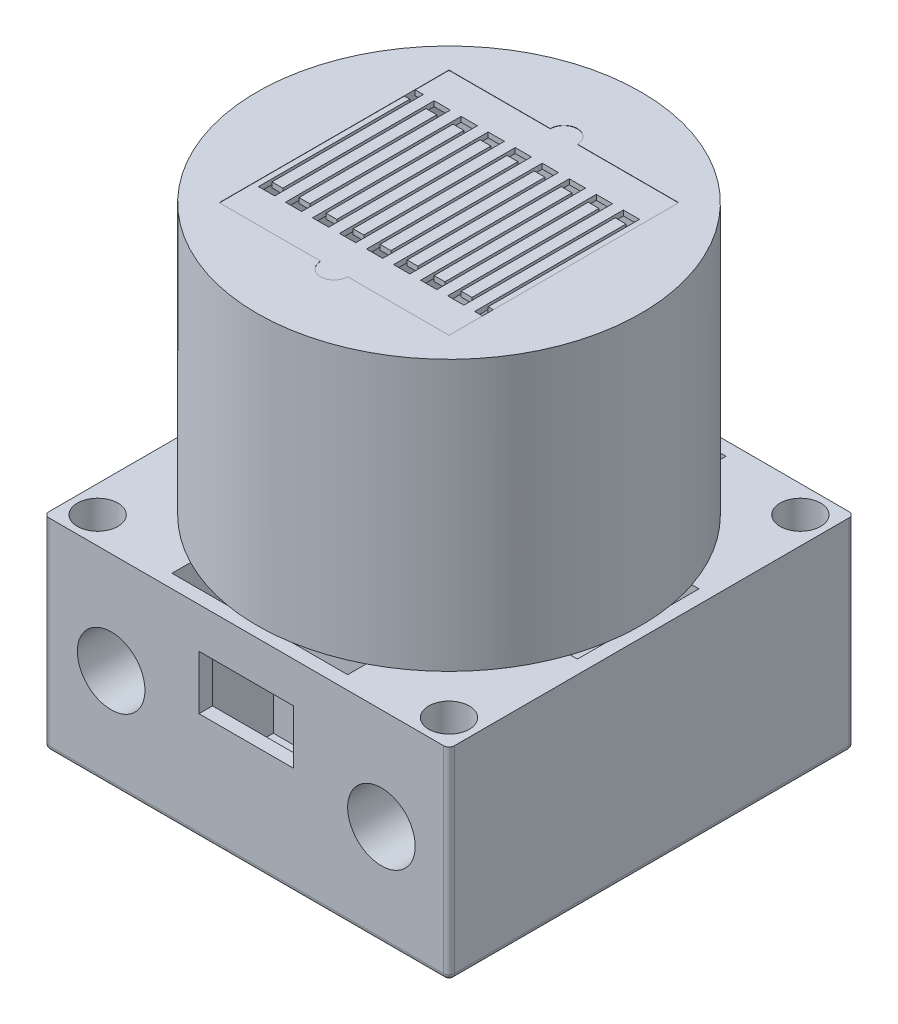
from build123d import *

# Parameters (mm, degrees)
SKETCH_2_W                      = 15
SKETCH_2_H                      = 15
EXTRUDE_1_DEPTH                 = 7.5
SKETCH_3_W                      = 14
SKETCH_3_H                      = 4.5
CUT_EXTRUDE_1_DEPTH             = 7
SKETCH_4_R                      = 3
CUT_EXTRUDE_2_DEPTH             = 4.5
SKETCH_5_W                      = 6.5
SKETCH_5_H                      = 3.75
CUT_EXTRUDE_3_DEPTH             = 7
EXTRUDE_2_REACH                 = 20.371
SKETCH_6_R                      = 1.5
SKETCH_7_R                      = 1.25
CUT_EXTRUDE_4_DEPTH             = 19.371173071
SKETCH_8_W                      = 3
SKETCH_8_H                      = 3
EXTRUDE_3_DEPTH                 = 1
CUT_EXTRUDE_5_REACH             = 20.371
SKETCH_9_W                      = 3.5
SKETCH_9_H                      = 2
CUT_EXTRUDE_6_REACH             = 35.371
CUT_EXTRUDE_START               = -15
SKETCH_9_2_W                    = 3.5
SKETCH_9_2_H                    = 2
EXTRUDE_4_DEPTH                 = 2
EXTRUDE_4_DEPTH_BACK            = 2
CUT_EXTRUDE_7_REACH             = 14.99
CUT_EXTRUDE_7_DIRECTION_2_REACH = 14.99
FILLET_1_R                      = 0.1
FILLET_2_R                      = 0.2
SKETCH_12_R                     = 0.75
CUT_EXTRUDE_8_DEPTH             = 2
SKETCH_13_W                     = 11.5
SKETCH_13_H                     = 4
EXTRUDE_5_DEPTH                 = 1
SKETCH_14_R                     = 2.9
EXTRUDE_6_DEPTH                 = 4
SKETCH_15_R                     = 2.5
CUT_EXTRUDE_9_DEPTH             = 3.5
SKETCH_19_R                     = 7.1
SKETCH_19_W                     = 8.5
SKETCH_19_H                     = 8.5
EXTRUDE_11_DEPTH                = 10
SKETCH_20_W                     = 8.5
SKETCH_20_H                     = 8.5
EXTRUDE_12_DEPTH                = 0.2
CUT_EXTRUDE_10_DEPTH            = 0.2
PATTERN_LINEAR_1_COUNT          = 8
PATTERN_LINEAR_1_PITCH          = 1
CUT_EXTRUDE_12_DEPTH            = 0.2
CUT_EXTRUDE_13_DEPTH            = 0.01


with BuildPart() as part:
    # 草图2 → 凸台-拉伸1 (new body)
    with BuildSketch(Plane(origin=(0, 0, 0), x_dir=(1, 0, 0), z_dir=(0, 1, 0))):
        Rectangle(SKETCH_2_W, SKETCH_2_H)
    extrude(amount=EXTRUDE_1_DEPTH)

    # 草图3 → 切除-拉伸1 (cut)
    with BuildSketch(Plane(origin=(0, 7.5, 0), x_dir=(-1, 0, 0), z_dir=(0, 1, 0))):
        Rectangle(SKETCH_3_W, SKETCH_3_H)
    extrude(amount=-CUT_EXTRUDE_1_DEPTH, mode=Mode.SUBTRACT)

    # 草图4 → 切除-拉伸2 (cut)
    with BuildSketch(Plane(origin=(0, 7.5, 0), x_dir=(1, 0, 0), z_dir=(0, 1, 0))):
        Circle(SKETCH_4_R)
    extrude(amount=-CUT_EXTRUDE_2_DEPTH, mode=Mode.SUBTRACT)

    # 草图5 → 切除-拉伸3 (cut)
    with BuildSketch(Plane(origin=(0, 7.5, 0), x_dir=(-1, 0, 0), z_dir=(0, 1, 0))):
        with Locations((0, -5.125)):
            Rectangle(SKETCH_5_W, SKETCH_5_H)
        with Locations((0, 5.125)):
            Rectangle(SKETCH_5_W, SKETCH_5_H)
    extrude(amount=-CUT_EXTRUDE_3_DEPTH, mode=Mode.SUBTRACT)

    # 草图6 → 凸台-拉伸2 (add, up to next)
    with BuildSketch(Plane.XY.offset(7.5), mode=Mode.PRIVATE) as extrude_2_sk1:
        with Locations((-5, 3.75)):
            Circle(SKETCH_6_R)
    extrude_2_tool1 = extrude(extrude_2_sk1.sketch, amount=-EXTRUDE_2_REACH, mode=Mode.PRIVATE) - part.part
    # 草图6 → 凸台-拉伸2 (add, up to next)
    with BuildSketch(Plane.XY.offset(7.5), mode=Mode.PRIVATE) as extrude_2_sk2:
        with Locations((5, 3.75)):
            Circle(SKETCH_6_R)
    extrude_2_tool2 = extrude(extrude_2_sk2.sketch, amount=-EXTRUDE_2_REACH, mode=Mode.PRIVATE) - part.part
    add(extrude_2_tool1.solids().sort_by_distance((-5, 3.75, 7.5))[0])
    add(extrude_2_tool2.solids().sort_by_distance((5, 3.75, 7.5))[0])

    # 草图7 → 切除-拉伸4 (cut, through all)
    with BuildSketch(Plane.XY.offset(7.5)):
        with Locations((-5, 3.75)):
            Circle(SKETCH_7_R)
        with Locations((5, 3.75)):
            Circle(SKETCH_7_R)
    extrude(amount=-CUT_EXTRUDE_4_DEPTH, mode=Mode.SUBTRACT)

    # 草图8 → 凸台-拉伸3 (add)
    with BuildSketch(Plane.XZ):
        Rectangle(SKETCH_8_W, SKETCH_8_H)
    extrude(amount=EXTRUDE_3_DEPTH)

    # 草图9 → 切除-拉伸5 (cut, up to next)
    with BuildSketch(Plane.XY.offset(7.5), mode=Mode.PRIVATE) as cut_extrude_5_sk1:
        with Locations((0, 5)):
            Rectangle(SKETCH_9_W, SKETCH_9_H)
    cut_extrude_5_tool1 = extrude(cut_extrude_5_sk1.sketch, amount=-CUT_EXTRUDE_5_REACH, mode=Mode.PRIVATE) & part.part
    add(cut_extrude_5_tool1.solids().sort_by_distance((0, 5, 7.5))[0], mode=Mode.SUBTRACT)

    # 草图9<2> → 切除-拉伸6 (cut, up to next)
    with BuildSketch(Plane.XY.offset(7.5).offset(CUT_EXTRUDE_START), mode=Mode.PRIVATE) as cut_extrude_6_sk1:
        with Locations((0, 5)):
            Rectangle(SKETCH_9_2_W, SKETCH_9_2_H)
    cut_extrude_6_tool1 = extrude(cut_extrude_6_sk1.sketch, amount=CUT_EXTRUDE_6_REACH, mode=Mode.PRIVATE) & part.part
    add(cut_extrude_6_tool1.solids().sort_by_distance((0, 5, -7.5))[0], mode=Mode.SUBTRACT)

    # 草图10 → 凸台-拉伸4 (add, two sides: drawn at the far end of the back side and taken through both)
    with BuildSketch(Plane.XY.offset(-EXTRUDE_4_DEPTH_BACK)):
        with BuildLine():
            Line((-1.95, -2.5), (1.95, -2.5))
            Line((1.95, -2.5), (1.95, -1.555590279))
            ThreePointArc((1.95, -1.555590279), (1.780042303, -1.088161527), (1.5, -0.677124344))
            Line((1.5, -0.677124344), (-1.5, -0.677124344))
            ThreePointArc((-1.5, -0.677124344), (-1.780042303, -1.088161527), (-1.95, -1.555590279))
            Line((-1.95, -1.555590279), (-1.95, -2.5))
        make_face()
    extrude(amount=EXTRUDE_4_DEPTH + EXTRUDE_4_DEPTH_BACK)

    # 草图11 → 切除-拉伸7 (cut, up to next)
    with BuildSketch(Plane(origin=(0, 0, 0), x_dir=(0, 0, -1), z_dir=(1, 0, 0)), mode=Mode.PRIVATE) as cut_extrude_7_sk1:
        with BuildLine():
            Line((1.95, -2.5), (1.95, -1.555590279))
            ThreePointArc((1.95, -1.555590279), (1.780042303, -1.088161527), (1.5, -0.677124344))
            Line((1.5, -0.677124344), (2, -0.677124344))
            Line((2, -0.677124344), (2, -2.5))
            Line((2, -2.5), (1.95, -2.5))
        make_face()
    cut_extrude_7_tool1 = extrude(cut_extrude_7_sk1.sketch, amount=-CUT_EXTRUDE_7_REACH, mode=Mode.PRIVATE) & part.part
    # 草图11 → 切除-拉伸7 (cut, up to next)
    with BuildSketch(Plane(origin=(0, 0, 0), x_dir=(0, 0, -1), z_dir=(1, 0, 0)), mode=Mode.PRIVATE) as cut_extrude_7_sk2:
        with BuildLine():
            Line((-1.95, -2.5), (-1.95, -1.555590279))
            ThreePointArc((-1.95, -1.555590279), (-1.780042303, -1.088161527), (-1.5, -0.677124344))
            Line((-1.5, -0.677124344), (-2, -0.677124344))
            Line((-2, -0.677124344), (-2, -2.5))
            Line((-2, -2.5), (-1.95, -2.5))
        make_face()
    cut_extrude_7_tool2 = extrude(cut_extrude_7_sk2.sketch, amount=-CUT_EXTRUDE_7_REACH, mode=Mode.PRIVATE) & part.part
    add(cut_extrude_7_tool1.solids().sort_by_distance((0, -1.175075, -1.873038))[0], mode=Mode.SUBTRACT)
    add(cut_extrude_7_tool2.solids().sort_by_distance((0, -1.175075, 1.873038))[0], mode=Mode.SUBTRACT)

    # 草图11 → 切除-拉伸7 direction 2 (cut, up to next)
    with BuildSketch(Plane(origin=(0, 0, 0), x_dir=(0, 0, -1), z_dir=(1, 0, 0)), mode=Mode.PRIVATE) as cut_extrude_7_direction_2_sk1:
        with BuildLine():
            Line((1.95, -2.5), (1.95, -1.555590279))
            ThreePointArc((1.95, -1.555590279), (1.780042303, -1.088161527), (1.5, -0.677124344))
            Line((1.5, -0.677124344), (2, -0.677124344))
            Line((2, -0.677124344), (2, -2.5))
            Line((2, -2.5), (1.95, -2.5))
        make_face()
    cut_extrude_7_direction_2_tool1 = extrude(cut_extrude_7_direction_2_sk1.sketch, amount=CUT_EXTRUDE_7_DIRECTION_2_REACH, mode=Mode.PRIVATE) & part.part
    # 草图11 → 切除-拉伸7 direction 2 (cut, up to next)
    with BuildSketch(Plane(origin=(0, 0, 0), x_dir=(0, 0, -1), z_dir=(1, 0, 0)), mode=Mode.PRIVATE) as cut_extrude_7_direction_2_sk2:
        with BuildLine():
            Line((-1.95, -2.5), (-1.95, -1.555590279))
            ThreePointArc((-1.95, -1.555590279), (-1.780042303, -1.088161527), (-1.5, -0.677124344))
            Line((-1.5, -0.677124344), (-2, -0.677124344))
            Line((-2, -0.677124344), (-2, -2.5))
            Line((-2, -2.5), (-1.95, -2.5))
        make_face()
    cut_extrude_7_direction_2_tool2 = extrude(cut_extrude_7_direction_2_sk2.sketch, amount=CUT_EXTRUDE_7_DIRECTION_2_REACH, mode=Mode.PRIVATE) & part.part
    add(cut_extrude_7_direction_2_tool1.solids().sort_by_distance((0, -1.175075, -1.873038))[0], mode=Mode.SUBTRACT)
    add(cut_extrude_7_direction_2_tool2.solids().sort_by_distance((0, -1.175075, 1.873038))[0], mode=Mode.SUBTRACT)

    # 圆角1
    fillet_1_edges = [part.edges().sort_by_distance(p)[0] for p in [
        (-1.95, -2.5, 0),
        (1.95, -2.5, 0),
        (0, -2.5, -1.95),
        (0, -2.5, 1.95),
    ]]
    fillet(fillet_1_edges, radius=FILLET_1_R)

    # 圆角2
    fillet_2_edges = [part.edges().sort_by_distance(p)[0] for p in [
        (0, 0, -7.5),
        (7.5, 0, 0),
        (0, 0, 7.5),
        (-7.5, 0, 0),
        (-7.5, 3.75, -7.5),
        (7.5, 3.75, -7.5),
        (7.5, 3.75, 7.5),
        (-7.5, 3.75, 7.5),
    ]]
    fillet(fillet_2_edges, radius=FILLET_2_R)

    # 草图12 → 切除-拉伸8 (cut)
    with BuildSketch(Plane(origin=(0, 7.5, 0), x_dir=(-1, 0, 0), z_dir=(0, 1, 0))):
        with Locations(Location((6.5, -6.5, 0), (0, 0, 90))):
            Circle(SKETCH_12_R)
        with Locations(Location((-6.5, 6.5, 0), (0, 0, 90))):
            Circle(SKETCH_12_R)
        with Locations(Location((6.5, 6.5, 0), (0, 0, 90))):
            Circle(SKETCH_12_R)
        with Locations(Location((-6.5, -6.5, 0), (0, 0, 90))):
            Circle(SKETCH_12_R)
    extrude(amount=-CUT_EXTRUDE_8_DEPTH, mode=Mode.SUBTRACT)



with BuildPart() as body_2:
    # 草图13 → 凸台-拉伸5 (new body)
    with BuildSketch(Plane(origin=(0, 7.5, 0), x_dir=(-1, 0, 0), z_dir=(0, 1, 0))):
        Rectangle(SKETCH_13_W, SKETCH_13_H)
    extrude(amount=-EXTRUDE_5_DEPTH)

    # 草图14 → 凸台-拉伸6 (add)
    with BuildSketch(Plane(origin=(0, 7.5, 0), x_dir=(-1, 0, 0), z_dir=(0, 1, 0))):
        with Locations(Location((0, 0, 0), (0, 0, 90))):
            Circle(SKETCH_14_R)
    extrude(amount=-EXTRUDE_6_DEPTH)

    # 草图15 → 切除-拉伸9 (cut)
    with BuildSketch(Plane(origin=(0, 7.5, 0), x_dir=(-1, 0, 0), z_dir=(0, 1, 0))):
        with Locations(Location((0, 0, 0), (0, 0, 90))):
            Circle(SKETCH_15_R)
    extrude(amount=-CUT_EXTRUDE_9_DEPTH, mode=Mode.SUBTRACT)

    # 草图16 → 旋转2 (revolve)
    with BuildSketch(Plane.XY):
        with BuildLine():
            Line((1.5, 4), (1.5, 6.000567678))
            ThreePointArc((1.5, 6.000567678), (1.060660172, 7.060660172), (0, 7.5))
            Line((0, 7.5), (0, 4))
            Line((0, 4), (1.5, 4))
        make_face()
    revolve(axis=Axis((0, -0.447775082, 0), (0, 1, 0)))


with BuildPart() as part_1:
    add(part.part)

    add(body_2.part)  # 凸台-拉伸11 merges body 2
    # 草图19 → 凸台-拉伸11 (add)
    with BuildSketch(Plane(origin=(0, 7.5, 0), x_dir=(1, 0, 0), z_dir=(0, 1, 0))):
        with Locations(Location((0, 0, 0), (0, 0, 80.372367317))):
            Circle(SKETCH_19_R)
        Rectangle(SKETCH_19_W, SKETCH_19_H, mode=Mode.SUBTRACT)
    extrude(amount=EXTRUDE_11_DEPTH)

    # 草图20 → 凸台-拉伸12 (add)
    with BuildSketch(Plane(origin=(0, 17.5, 0), x_dir=(1, 0, 0), z_dir=(0, 1, 0))):
        Rectangle(SKETCH_20_W, SKETCH_20_H)
    extrude(amount=-EXTRUDE_12_DEPTH)

    # 草图22 → 切除-拉伸10 (cut)
    with BuildSketch(Plane(origin=(0, 17.5, 0), x_dir=(1, 0, 0), z_dir=(0, 1, 0))):
        Polygon((-4.25, 3), (-4.25, 2.6), (-4.05, 2.6), (-4.05, -2.6), (-4.05, -3), (-3.45, -3), (-3.45, -2.6), (-3.45, 2.6), (-3.25, 2.6), (-3.25, 3), (-3.55, 3), (-3.55, 2.6), (-3.55, -2.6), (-3.95, -2.6), (-3.95, 2.6), (-3.95, 3), align=None)
    cut_extrude_10 = extrude(amount=-CUT_EXTRUDE_10_DEPTH, mode=Mode.SUBTRACT)

    # 阵列(线性)1: 切除-拉伸10 ×8
    with Locations(*[(i * PATTERN_LINEAR_1_PITCH, 0, 0) for i in range(1, PATTERN_LINEAR_1_COUNT)]):
        add(cut_extrude_10, mode=Mode.SUBTRACT)

    # 草图23 → 切除-拉伸12 (cut)
    with BuildSketch(Plane(origin=(0, 17.5, 0), x_dir=(1, 0, 0), z_dir=(0, 1, 0))):
        Polygon((3.75, 3), (3.75, 2.6), (3.95, 2.6), (3.95, -2.6), (3.95, -3), (4.25, -3), (4.25, -2.6), (4.05, -2.6), (4.05, 2.6), (4.05, 3), align=None)
    extrude(amount=-CUT_EXTRUDE_12_DEPTH, mode=Mode.SUBTRACT)

    # 草图25 → 切除-拉伸13 (cut)
    with BuildSketch(Plane(origin=(0, 17.5, 0), x_dir=(1, 0, 0), z_dir=(0, 1, 0))):
        with BuildLine():
            Line((4.25, 4.25), (0.5, 4.25))
            ThreePointArc((0.5, 4.25), (0, 4.75), (-0.5, 4.25))
            Line((-0.5, 4.25), (-4.25, 4.25))
            Line((-4.25, 4.25), (-4.25, -4.25))
            Line((-4.25, -4.25), (-0.5, -4.25))
            ThreePointArc((-0.5, -4.25), (0, -4.75), (0.5, -4.25))
            Line((0.5, -4.25), (4.25, -4.25))
            Line((4.25, -4.25), (4.25, 4.25))
        make_face()
    extrude(amount=-CUT_EXTRUDE_13_DEPTH, mode=Mode.SUBTRACT)


solid = part_1.part
